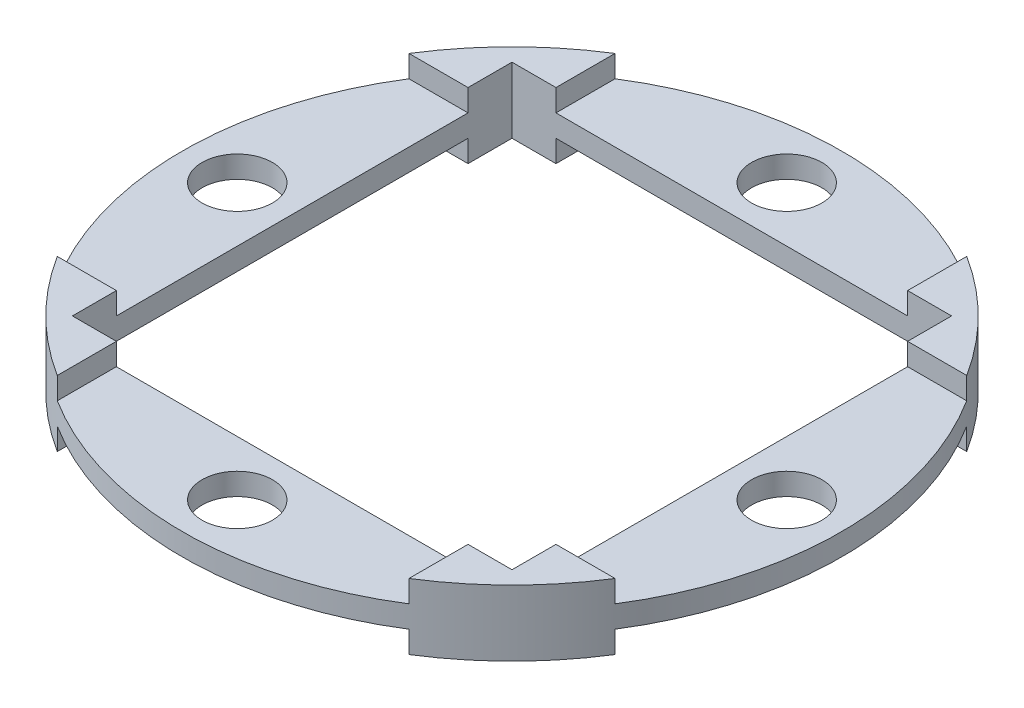
from build123d import *
from build123d.topology import SkipClean

# Parameters (mm, degrees)
SKETCH1_R           = 75
SKETCH1_W           = 100
SKETCH1_H           = 100
BOSS_EXTRUDE1_DEPTH = 5
SKETCH2_R           = 8
CUT_EXTRUDE1_DEPTH  = 10
BOSS_EXTRUDE2_DEPTH = 5
BOSS_EXTRUDE4_START = -15
BOSS_EXTRUDE4_DEPTH = 15


with BuildPart() as part:
    # Sketch1 → Boss-Extrude1 (new body)
    with BuildSketch(Plane(origin=(0, 0, 0), x_dir=(1, 0, 0), z_dir=(0, 1, 0))):
        with Locations(Location((0, 0, 0), (0, 0, 270))):
            Circle(SKETCH1_R)
        Rectangle(SKETCH1_W, SKETCH1_H, mode=Mode.SUBTRACT)
    extrude(amount=BOSS_EXTRUDE1_DEPTH)

    # Sketch2 → Cut-Extrude1 (cut)
    with BuildSketch(Plane(origin=(0, 5, 0), x_dir=(1, 0, 0), z_dir=(0, 1, 0))):
        with Locations(Location((-62.5, 0, 0), (0, 0, 270))):
            Circle(SKETCH2_R)
        with Locations(Location((0, 62.5, 0), (0, 0, 270))):
            Circle(SKETCH2_R)
        with Locations(Location((62.5, 0, 0), (0, 0, 270))):
            Circle(SKETCH2_R)
        with Locations(Location((0, -62.5, 0), (0, 0, 270))):
            Circle(SKETCH2_R)
    extrude(amount=-CUT_EXTRUDE1_DEPTH, mode=Mode.SUBTRACT)

    # Sketch3 → Boss-Extrude2 (add)
    with BuildSketch(Plane(origin=(0, 5, 0), x_dir=(1, 0, 0), z_dir=(0, 1, 0))):
        with BuildLine():
            Line((50, -50), (40, -50))
            Line((40, -50), (40, -63.442887702))
            ThreePointArc((40, -63.442887702), (53.033008589, -53.033008589), (63.442887702, -40))
            Line((63.442887702, -40), (50, -40))
            Line((50, -40), (50, -50))
        make_face()
        with BuildLine():
            Line((-40, -50), (-50, -50))
            Line((-50, -50), (-50, -40))
            Line((-50, -40), (-63.442887702, -40))
            ThreePointArc((-63.442887702, -40), (-53.033008589, -53.033008589), (-40, -63.442887702))
            Line((-40, -63.442887702), (-40, -50))
        make_face()
        with BuildLine():
            Line((-63.442887702, 40), (-50, 40))
            Line((-50, 40), (-50, 50))
            Line((-50, 50), (-40, 50))
            Line((-40, 50), (-40, 63.442887702))
            ThreePointArc((-40, 63.442887702), (-53.033008589, 53.033008589), (-63.442887702, 40))
        make_face()
        with BuildLine():
            Line((50, 50), (50, 40))
            Line((50, 40), (63.442887702, 40))
            ThreePointArc((63.442887702, 40), (53.033008589, 53.033008589), (40, 63.442887702))
            Line((40, 63.442887702), (40, 50))
            Line((40, 50), (50, 50))
        make_face()
    extrude(amount=BOSS_EXTRUDE2_DEPTH)

    # Sketch4 → Boss-Extrude4 (add)
    with SkipClean():  # the faces are left unmerged after this step: merging them gives an invalid solid
        with BuildSketch(Plane(origin=(0, 10, 0), x_dir=(1, 0, 0), z_dir=(0, 1, 0)).offset(BOSS_EXTRUDE4_START)):
            with BuildLine():
                Line((50, 50), (50, 40))
                Line((50, 40), (63.442887702, 40))
                ThreePointArc((63.442887702, 40), (53.033008589, 53.033008589), (40, 63.442887702))
                Line((40, 63.442887702), (40, 50))
                Line((40, 50), (50, 50))
            make_face()
            with BuildLine():
                Line((-50, 50), (-40, 50))
                Line((-40, 50), (-40, 63.442887702))
                ThreePointArc((-40, 63.442887702), (-53.033008589, 53.033008589), (-63.442887702, 40))
                Line((-63.442887702, 40), (-50, 40))
                Line((-50, 40), (-50, 50))
            make_face()
            with BuildLine():
                Line((-40, -63.442887702), (-40, -50))
                Line((-40, -50), (-50, -50))
                Line((-50, -50), (-50, -40))
                Line((-50, -40), (-63.442887702, -40))
                ThreePointArc((-63.442887702, -40), (-53.033008589, -53.033008589), (-40, -63.442887702))
            make_face()
            with BuildLine():
                Line((50, -50), (40, -50))
                Line((40, -50), (40, -63.442887702))
                ThreePointArc((40, -63.442887702), (53.033008589, -53.033008589), (63.442887702, -40))
                Line((63.442887702, -40), (50, -40))
                Line((50, -40), (50, -50))
            make_face()
        extrude(amount=BOSS_EXTRUDE4_DEPTH)


solid = part.part
